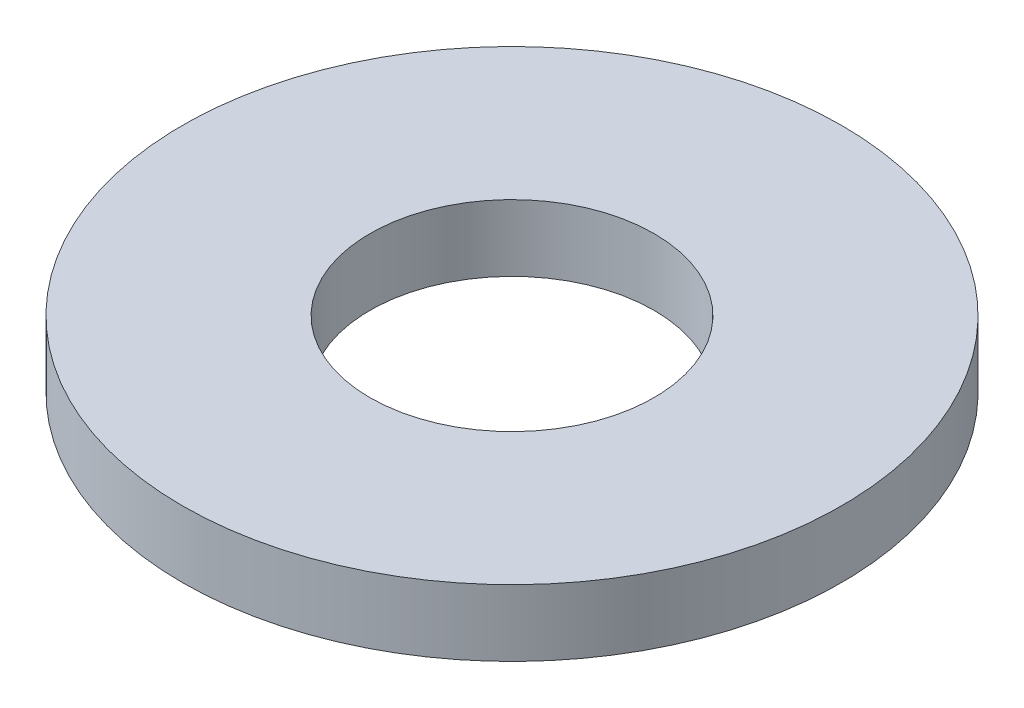
from build123d import *

# Parameters (mm, degrees)
SKETCH1_R           = 2.7686
BOSS_EXTRUDE1_DEPTH = 0.5588
SKETCH5_R           = 1.1938
CUT_EXTRUDE1_DEPTH  = 4.95506629


with BuildPart() as part:
    # Sketch1 → Boss-Extrude1 (new body)
    with BuildSketch(Plane(origin=(0, 0, 0), x_dir=(1, 0, 0), z_dir=(0, 1, 0))):
        with Locations(Location((0, 0, 0), (0, 0, 270))):
            Circle(SKETCH1_R)
    extrude(amount=BOSS_EXTRUDE1_DEPTH)

    # Sketch5 → Cut-Extrude1 (cut, through all)
    with BuildSketch(Plane(origin=(0, 0.5588, 0), x_dir=(-1, 0, 0), z_dir=(0, 1, 0))):
        with Locations(Location((0, 0, 0), (0, 0, 90))):
            Circle(SKETCH5_R)
    extrude(amount=-CUT_EXTRUDE1_DEPTH, mode=Mode.SUBTRACT)


solid = part.part
